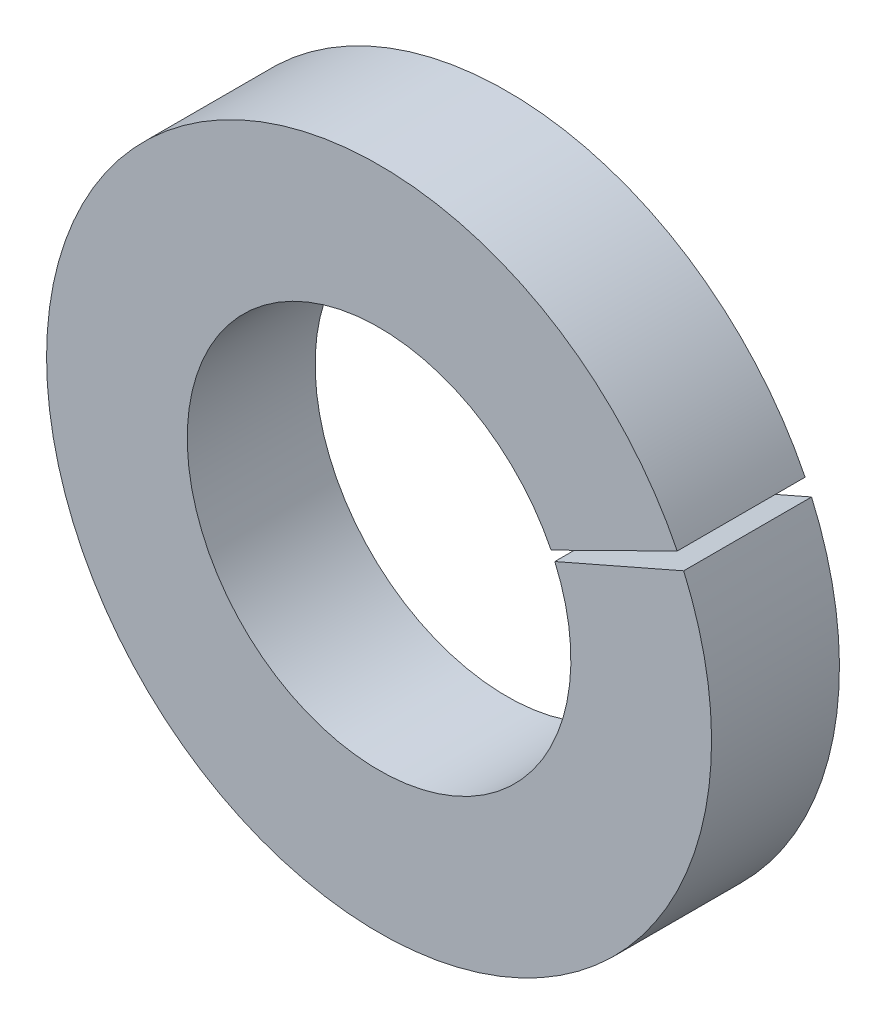
from build123d import *

# Parameters (mm, degrees)
SKETCH_1_R          = 2.6
SKETCH_1_R_2        = 1.5
EXTRUDE_1_DEPTH     = 1
CUT_EXTRUDE_1_DEPTH = 10


with BuildPart() as part:
    # 草图1 → 凸台-拉伸1 (new body)
    with BuildSketch(Plane.XY):
        Circle(SKETCH_1_R)
        Circle(SKETCH_1_R_2, mode=Mode.SUBTRACT)
    extrude(amount=EXTRUDE_1_DEPTH)

    # 草图2 → 切除-拉伸1 (cut)
    with BuildSketch(Plane.XY.offset(1)):
        Polygon((0, 0), (4.812459265, 2.375572201), (4.812459265, 2.105870497), align=None)
    extrude(amount=-CUT_EXTRUDE_1_DEPTH, mode=Mode.SUBTRACT)


solid = part.part
